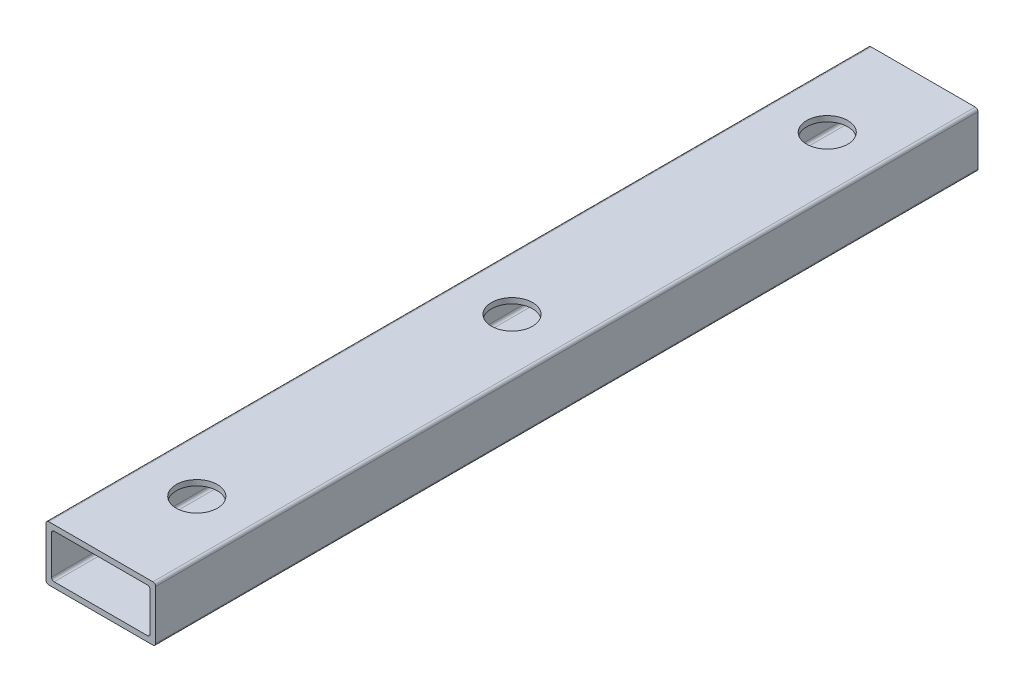
from build123d import *

# Parameters (mm, degrees)
BOSS_EXTRU_1_DEPTH      = 600
ESQUISSE2_R             = 15
ENL_V_MAT_EXTRU_1_DEPTH = 607.630035524


with BuildPart() as part:
    # Esquisse1 → Boss.-Extru.1 (new body)
    with BuildSketch(Plane.XY):
        with BuildLine():
            Line((2, -2), (78, -2))
            ThreePointArc((78, -2), (79.414213562, -1.414213562), (80, 0))
            Line((80, 0), (80, 36))
            ThreePointArc((80, 36), (79.414213562, 37.414213562), (78, 38))
            Line((78, 38), (2, 38))
            ThreePointArc((2, 38), (0.585786438, 37.414213562), (0, 36))
            Line((0, 36), (0, 0))
            ThreePointArc((0, 0), (0.585786438, -1.414213562), (2, -2))
        make_face()
        with BuildLine():
            Line((4, 4), (4, 32))
            ThreePointArc((4, 32), (4.585786438, 33.414213562), (6, 34))
            Line((6, 34), (74, 34))
            ThreePointArc((74, 34), (75.414213562, 33.414213562), (76, 32))
            Line((76, 32), (76, 4))
            ThreePointArc((76, 4), (75.414213562, 2.585786438), (74, 2))
            Line((74, 2), (6, 2))
            ThreePointArc((6, 2), (4.585786438, 2.585786438), (4, 4))
        make_face(mode=Mode.SUBTRACT)
    extrude(amount=BOSS_EXTRU_1_DEPTH)

    # Esquisse2 → Enlèv. mat.-Extru.1 (cut, through all)
    with BuildSketch(Plane(origin=(0, 38, 0), x_dir=(1, 0, 0), z_dir=(0, 1, 0))):
        with Locations(Location((40, -300, 0), (0, 0, 180))):
            Circle(ESQUISSE2_R)
        with Locations(Location((40, -70, 0), (0, 0, 180))):
            Circle(ESQUISSE2_R)
        with Locations(Location((40, -530, 0), (0, 0, 270))):
            Circle(ESQUISSE2_R)
    extrude(amount=-ENL_V_MAT_EXTRU_1_DEPTH, mode=Mode.SUBTRACT)


solid = part.part
